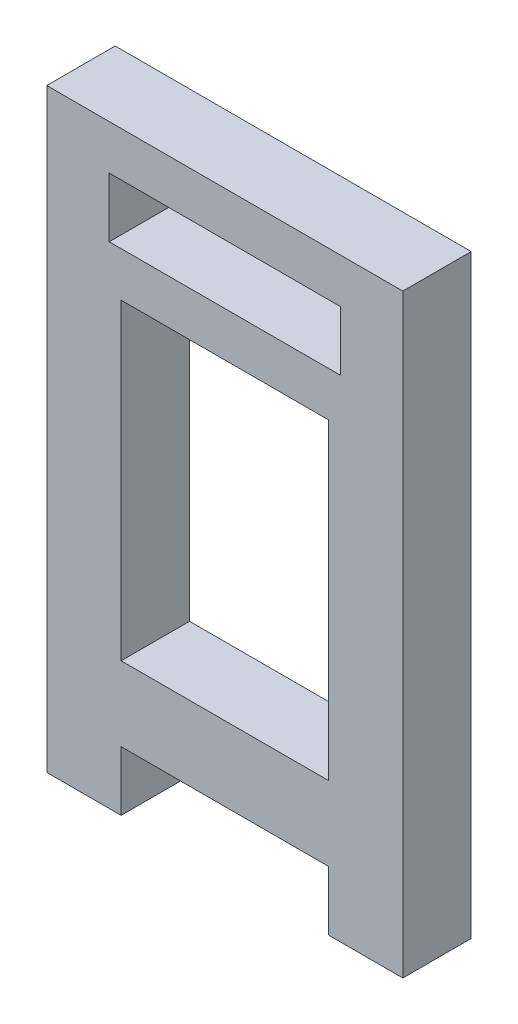
from build123d import *

# Parameters (mm, degrees)
SKETCH1_W           = 6.97
SKETCH1_H           = 10.5
SKETCH1_W_2         = 7.77
SKETCH1_H_2         = 2
BOSS_EXTRUDE1_DEPTH = 2.3


with BuildPart() as part:
    # Sketch1 → Boss-Extrude1 (new body)
    with BuildSketch(Plane.XY):
        Polygon((0, 0), (0, -2), (2.5, -2), (2.5, 0), (9.47, 0), (9.47, -2), (11.97, -2), (11.97, 0), (11.97, 18), (0, 18), align=None)
        with Locations((5.985, 7.75)):
            Rectangle(SKETCH1_W, SKETCH1_H, mode=Mode.SUBTRACT)
        with Locations((5.985, 15.5)):
            Rectangle(SKETCH1_W_2, SKETCH1_H_2, mode=Mode.SUBTRACT)
    extrude(amount=BOSS_EXTRUDE1_DEPTH)


solid = part.part
